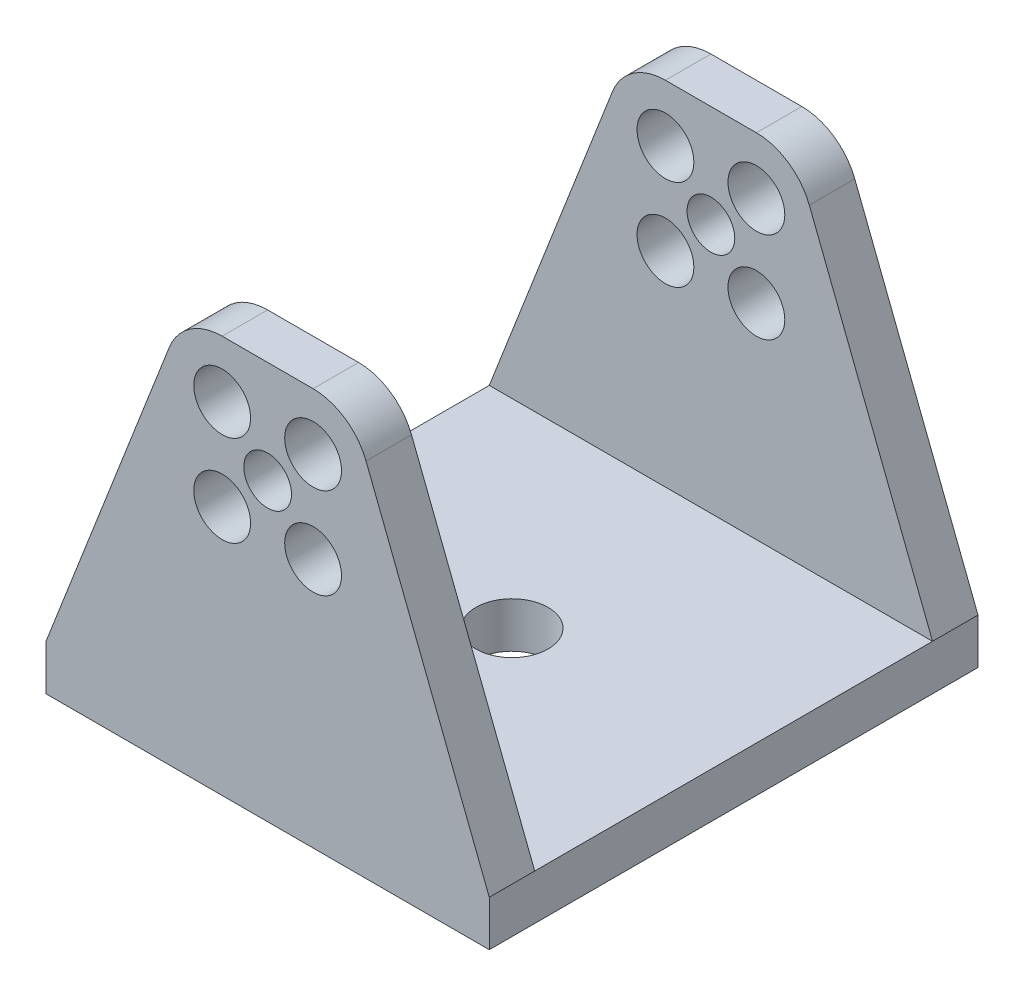
from build123d import *

# Parameters (mm, degrees)
SKETCH2_W                       = 39
SKETCH2_H                       = 43
SKETCH2_R                       = 3.175
BOSS_EXTRUDE1_DEPTH             = 4
BOSS_EXTRUDE2_REACH             = 55.226
SKETCH3_R                       = 2.5
SKETCH3_R_2                     = 2.1
BOSS_EXTRUDE2_DIRECTION_2_REACH = 55.226
SKETCH5_W                       = 35
SKETCH5_H                       = 44.559224728
CUT_EXTRUDE2_DEPTH              = 64.576725301


with BuildPart() as part:
    # Sketch2 → Boss-Extrude1 (new body)
    with BuildSketch(Plane(origin=(0, 0, 0), x_dir=(1, 0, 0), z_dir=(0, 1, 0))):
        with Locations((19.5, 14.5)):
            Rectangle(SKETCH2_W, SKETCH2_H)
        with Locations(Location((19.5, 14.5, 0), (0, 0, 270))):
            Circle(SKETCH2_R, mode=Mode.SUBTRACT)
    extrude(amount=BOSS_EXTRUDE1_DEPTH)

    # Boss-Extrude2: up to this face of the body (flat: up to its plane)
    boss_extrude2_end = Plane(part.part.faces().sort_by_distance((19.5, 2, 7))[0])
    # Sketch3 → Boss-Extrude2 (add, up to the picked face)
    with BuildSketch(Plane.XY, mode=Mode.PRIVATE) as boss_extrude2_sk1:
        with BuildLine():
            Line((39, 4), (28.158657967, 31.815738403))
            ThreePointArc((28.158657967, 31.815738403), (26.321463094, 34.127874272), (23.5, 35))
            Line((23.5, 35), (15.5, 35))
            ThreePointArc((15.5, 35), (12.678536906, 34.127874272), (10.841342033, 31.815738403))
            Line((10.841342033, 31.815738403), (0, 4))
            Line((0, 4), (39, 4))
        make_face()
        with Locations(Location((15.5, 30, 0), (0, 0, 180))):
            Circle(SKETCH3_R, mode=Mode.SUBTRACT)
        with Locations(Location((23.5, 30, 0), (0, 0, 180))):
            Circle(SKETCH3_R, mode=Mode.SUBTRACT)
        with Locations(Location((23.5, 22, 0), (0, 0, 180))):
            Circle(SKETCH3_R, mode=Mode.SUBTRACT)
        with Locations(Location((15.5, 22, 0), (0, 0, 180))):
            Circle(SKETCH3_R, mode=Mode.SUBTRACT)
        with Locations(Location((19.5, 26, 0), (0, 0, 180))):
            Circle(SKETCH3_R_2, mode=Mode.SUBTRACT)
    boss_extrude2_tool1 = split(extrude(boss_extrude2_sk1.sketch, amount=BOSS_EXTRUDE2_REACH, mode=Mode.PRIVATE), bisect_by=boss_extrude2_end, keep=Keep.BOTH, mode=Mode.PRIVATE)
    add(boss_extrude2_tool1.solids().sort_by(Axis((19.5, 15.979018, 0), (0, 0, 1)))[0])

    # Boss-Extrude2 direction 2: up to this face of the body (flat: up to its plane)
    boss_extrude2_direction_2_end = Plane(part.part.faces().sort_by_distance((19.5, 2, -36))[0])
    # Sketch3 → Boss-Extrude2 direction 2 (add, up to the picked face)
    with BuildSketch(Plane.XY, mode=Mode.PRIVATE) as boss_extrude2_direction_2_sk1:
        with BuildLine():
            Line((39, 4), (28.158657967, 31.815738403))
            ThreePointArc((28.158657967, 31.815738403), (26.321463094, 34.127874272), (23.5, 35))
            Line((23.5, 35), (15.5, 35))
            ThreePointArc((15.5, 35), (12.678536906, 34.127874272), (10.841342033, 31.815738403))
            Line((10.841342033, 31.815738403), (0, 4))
            Line((0, 4), (39, 4))
        make_face()
        with Locations(Location((15.5, 30, 0), (0, 0, 180))):
            Circle(SKETCH3_R, mode=Mode.SUBTRACT)
        with Locations(Location((23.5, 30, 0), (0, 0, 180))):
            Circle(SKETCH3_R, mode=Mode.SUBTRACT)
        with Locations(Location((23.5, 22, 0), (0, 0, 180))):
            Circle(SKETCH3_R, mode=Mode.SUBTRACT)
        with Locations(Location((15.5, 22, 0), (0, 0, 180))):
            Circle(SKETCH3_R, mode=Mode.SUBTRACT)
        with Locations(Location((19.5, 26, 0), (0, 0, 180))):
            Circle(SKETCH3_R_2, mode=Mode.SUBTRACT)
    boss_extrude2_direction_2_tool1 = split(extrude(boss_extrude2_direction_2_sk1.sketch, amount=-BOSS_EXTRUDE2_DIRECTION_2_REACH, mode=Mode.PRIVATE), bisect_by=boss_extrude2_direction_2_end, keep=Keep.BOTH, mode=Mode.PRIVATE)
    add(boss_extrude2_direction_2_tool1.solids().sort_by(Axis((19.5, 15.979018, 0), (0, 0, -1)))[0])

    # Sketch5 → Cut-Extrude2 (cut, through all)
    with BuildSketch(Plane(origin=(0, 0, 0), x_dir=(0, 0, -1), z_dir=(1, 0, 0))):
        with Locations((14.5, 26.279612364)):
            Rectangle(SKETCH5_W, SKETCH5_H)
    extrude(amount=CUT_EXTRUDE2_DEPTH, mode=Mode.SUBTRACT)


solid = part.part
